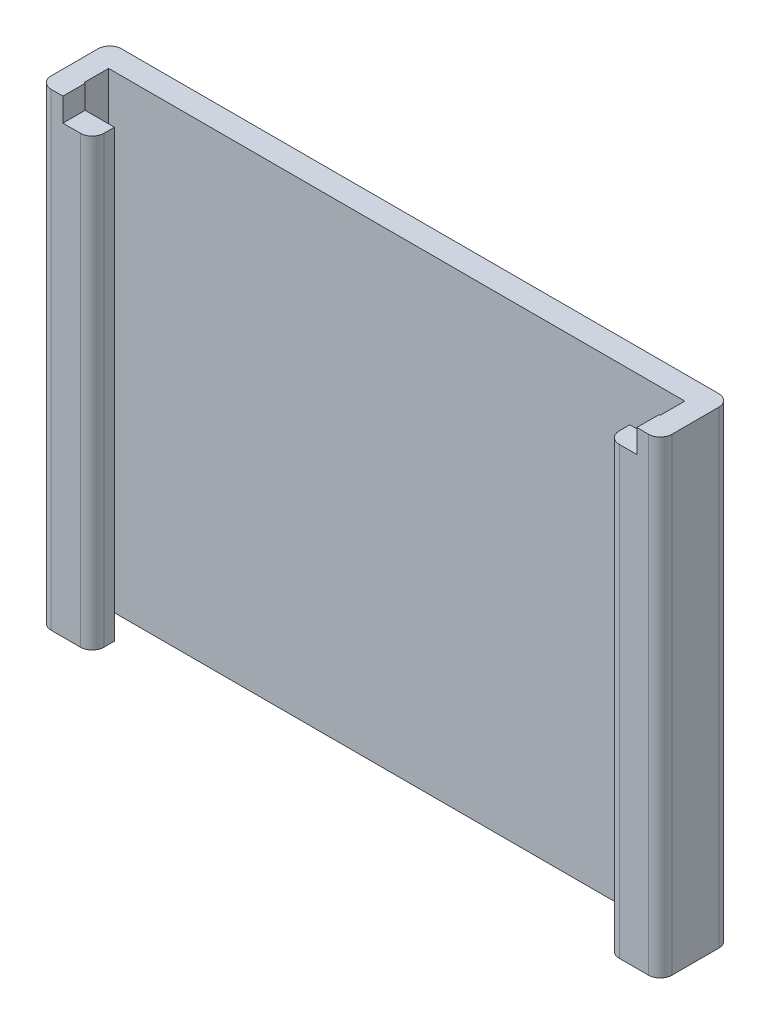
from build123d import *

# Parameters (mm, degrees)
BOSS_EXTRUDE1_DEPTH = 40
FILLET1_R           = 1
SKETCH3_W           = 3.059746362
SKETCH3_H           = 2.82490347
CUT_EXTRUDE1_DEPTH  = 2
SKETCH2_W           = 2.5
SKETCH2_H           = 2
SKETCH2_H_2         = 2.1
CUT_EXTRUDE2_DEPTH  = 45
SKETCH6_W           = 0.1
SKETCH6_H           = 2.1
CUT_EXTRUDE3_DEPTH  = 40


with BuildPart() as part:
    # Sketch1 → Boss-Extrude1 (new body)
    with BuildSketch(Plane(origin=(0, 0, 0), x_dir=(1, 0, 0), z_dir=(0, 1, 0))):
        Polygon((26.5, 2), (-26.5, 2), (-26.5, -4), (-22, -4), (-22, -2), (-24.5, -2), (-24.5, 0), (24.5, 0), (24.5, -2), (22, -2), (22, -4), (26.5, -4), align=None)
    extrude(amount=BOSS_EXTRUDE1_DEPTH)

    # Fillet1
    fillet1_edges = [part.edges().sort_by_distance(p)[0] for p in [
        (22, 20, 4),
        (26.5, 20, 4),
        (26.5, 20, -2),
        (-26.5, 20, -2),
        (-26.5, 20, 4),
        (-22, 20, 4),
    ]]
    fillet(fillet1_edges, radius=FILLET1_R)

    # Sketch3 → Cut-Extrude1 (cut)
    with BuildSketch(Plane(origin=(0, 40, 0), x_dir=(1, 0, 0), z_dir=(0, 1, 0))):
        Polygon((-24.5, -4.82490347), (-21.440253638, -4.82490347), (-21.343886973, -2.1), (-24.5, -2.1), align=None)
        with Locations((22.970126819, -3.412451735)):
            Rectangle(SKETCH3_W, SKETCH3_H)
    extrude(amount=-CUT_EXTRUDE1_DEPTH, mode=Mode.SUBTRACT)

    # Sketch2 → Cut-Extrude2 (cut)
    with BuildSketch(Plane(origin=(0, 0, 0), x_dir=(1, 0, 0), z_dir=(0, 1, 0))):
        with Locations((23.25, -1)):
            Rectangle(SKETCH2_W, SKETCH2_H)
        with Locations((-23.25, -1.05)):
            Rectangle(SKETCH2_W, SKETCH2_H_2)
    cut_extrude2 = extrude(amount=CUT_EXTRUDE2_DEPTH, mode=Mode.SUBTRACT)

    # Mirror1: Cut-Extrude2 across plane
    add(cut_extrude2.mirror(Plane(origin=(0, 0, 0), x_dir=(0, 0, 1), z_dir=(1, 0, 0))), mode=Mode.SUBTRACT)

    # Sketch6 → Cut-Extrude3 (cut)
    with BuildSketch(Plane(origin=(0, 40, 0), x_dir=(1, 0, 0), z_dir=(0, 1, 0))):
        with Locations((-24.55, -1.05)):
            Rectangle(SKETCH6_W, SKETCH6_H)
        with Locations((24.55, -1.05)):
            Rectangle(SKETCH6_W, SKETCH6_H)
    extrude(amount=-CUT_EXTRUDE3_DEPTH, mode=Mode.SUBTRACT)


solid = part.part
